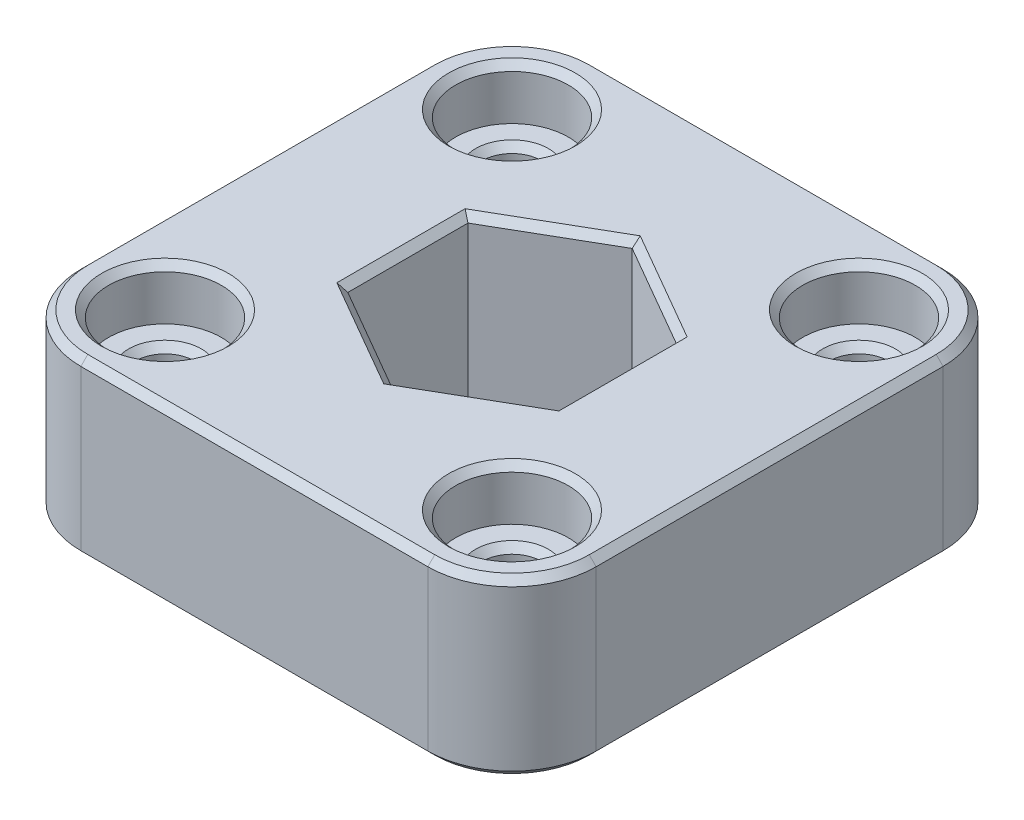
from build123d import *

# Parameters (mm, degrees)
BOSS_EXTRUDE1_DEPTH           = 10
CBORE_FOR_M3_SHCS1_AT_2_COUNT = 2
CBORE_FOR_M3_SHCS1_AT_2_PITCH = 20
CBORE_FOR_M3_SHCS1_AT_3_COUNT = 2
CBORE_FOR_M3_SHCS1_AT_3_PITCH = 28.284271247
CBORE_FOR_M3_SHCS1_AT_4_COUNT = 2
CBORE_FOR_M3_SHCS1_AT_4_PITCH = 20
CHAMFER1_SIZE                 = 0.4


with BuildPart() as part:
    # Sketch3 → Boss-Extrude1 (new body)
    with BuildSketch(Plane(origin=(0, 0, 0), x_dir=(1, 0, 0), z_dir=(0, 1, 0))):
        with BuildLine():
            Line((-14.85, -10), (-14.85, 10))
            ThreePointArc((-14.85, 10), (-13.429467889, 13.429467889), (-10, 14.85))
            Line((-10, 14.85), (10, 14.85))
            ThreePointArc((10, 14.85), (13.429467889, 13.429467889), (14.85, 10))
            Line((14.85, 10), (14.85, -10))
            ThreePointArc((14.85, -10), (13.429467889, -13.429467889), (10, -14.85))
            Line((10, -14.85), (-10, -14.85))
            ThreePointArc((-10, -14.85), (-13.429467889, -13.429467889), (-14.85, -10))
        make_face()
        Polygon((-6, 3.464101615), (-6, -3.464101615), (0, -6.92820323), (6, -3.464101615), (6, 3.464101615), (0, 6.92820323), align=None, mode=Mode.SUBTRACT)
    extrude(amount=BOSS_EXTRUDE1_DEPTH)

    # Sketch5 → CBORE for M3 SHCS1 (revolve, cut)
    with BuildSketch(Plane(origin=(-10, 10, -10), x_dir=(0, 0, 1), z_dir=(1, 0, 0))):
        Polygon((0, 0), (0, 10), (2.1, 10), (1.7, 9.6), (1.7, 3.4), (2.1, 3), (3.25, 3), (3.25, 0.4), (3.65, 0), align=None)
    cbore_for_m3_shcs1 = revolve(axis=Axis((-10, 16.35, -10), (0, -1, 0)), mode=Mode.SUBTRACT)

    # CBORE for M3 SHCS1 at 2: CBORE for M3 SHCS1 ×2
    with Locations(*[(i * CBORE_FOR_M3_SHCS1_AT_2_PITCH, 0, 0) for i in range(1, CBORE_FOR_M3_SHCS1_AT_2_COUNT)]):
        add(cbore_for_m3_shcs1, mode=Mode.SUBTRACT)

    # CBORE for M3 SHCS1 at 3: CBORE for M3 SHCS1 ×2
    with Locations(*[Vector(0.7071067811865476, 0, 0.7071067811865476) * (i * CBORE_FOR_M3_SHCS1_AT_3_PITCH) for i in range(1, CBORE_FOR_M3_SHCS1_AT_3_COUNT)]):
        add(cbore_for_m3_shcs1, mode=Mode.SUBTRACT)

    # CBORE for M3 SHCS1 at 4: CBORE for M3 SHCS1 ×2
    with Locations(*[(0, 0, i * CBORE_FOR_M3_SHCS1_AT_4_PITCH) for i in range(1, CBORE_FOR_M3_SHCS1_AT_4_COUNT)]):
        add(cbore_for_m3_shcs1, mode=Mode.SUBTRACT)

    # Chamfer1
    chamfer1_edges = [part.edges().sort_by_distance(p)[0] for p in [
        (14.85, 0, 0),
        (13.429467889, 0, 13.429467889),
        (0, 0, 14.85),
        (-13.429467889, 0, 13.429467889),
        (13.429467889, 10, 13.429467889),
        (14.85, 10, 0),
        (13.429467889, 10, -13.429467889),
        (0, 10, -14.85),
        (-3, 0, -5.196152423),
        (-6, 0, 0),
        (-3, 0, 5.196152423),
        (3, 0, 5.196152423),
        (6, 0, 0),
        (3, 0, -5.196152423),
        (-3, 10, -5.196152423),
        (-6, 10, 0),
        (-13.429467889, 10, -13.429467889),
        (-3, 10, 5.196152423),
        (3, 10, 5.196152423),
        (6, 10, 0),
        (3, 10, -5.196152423),
        (-14.85, 10, 0),
        (-13.429467889, 10, 13.429467889),
        (-14.85, 0, 0),
        (0, 10, 14.85),
        (-13.429467889, 0, -13.429467889),
        (0, 0, -14.85),
        (13.429467889, 0, -13.429467889),
    ]]
    chamfer(chamfer1_edges, length=CHAMFER1_SIZE)


solid = part.part
